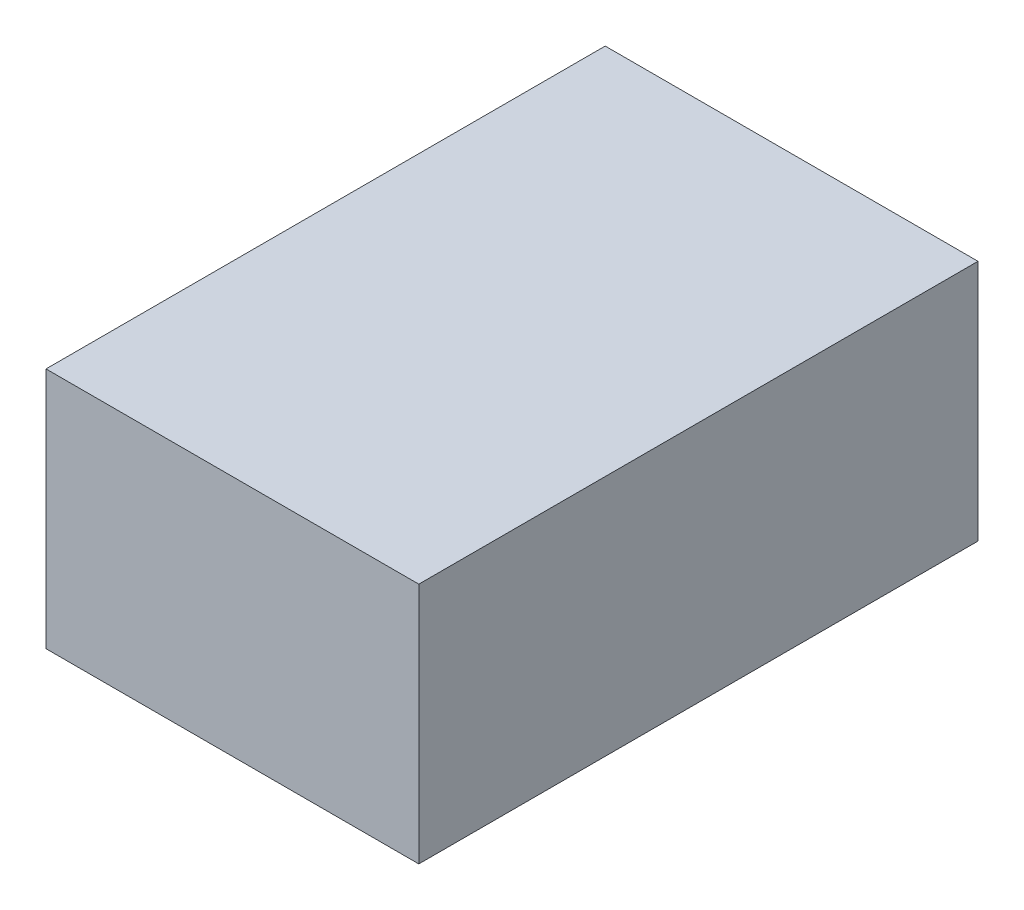
from build123d import *

# Parameters (mm, degrees)
SKETCH1_W           = 10
SKETCH1_H           = 15
BOSS_EXTRUDE1_DEPTH = 6.5


with BuildPart() as part:
    # Sketch1 → Boss-Extrude1 (new body)
    with BuildSketch(Plane(origin=(0, 0, 0), x_dir=(1, 0, 0), z_dir=(0, 1, 0))):
        Rectangle(SKETCH1_W, SKETCH1_H)
    extrude(amount=BOSS_EXTRUDE1_DEPTH)


solid = part.part
